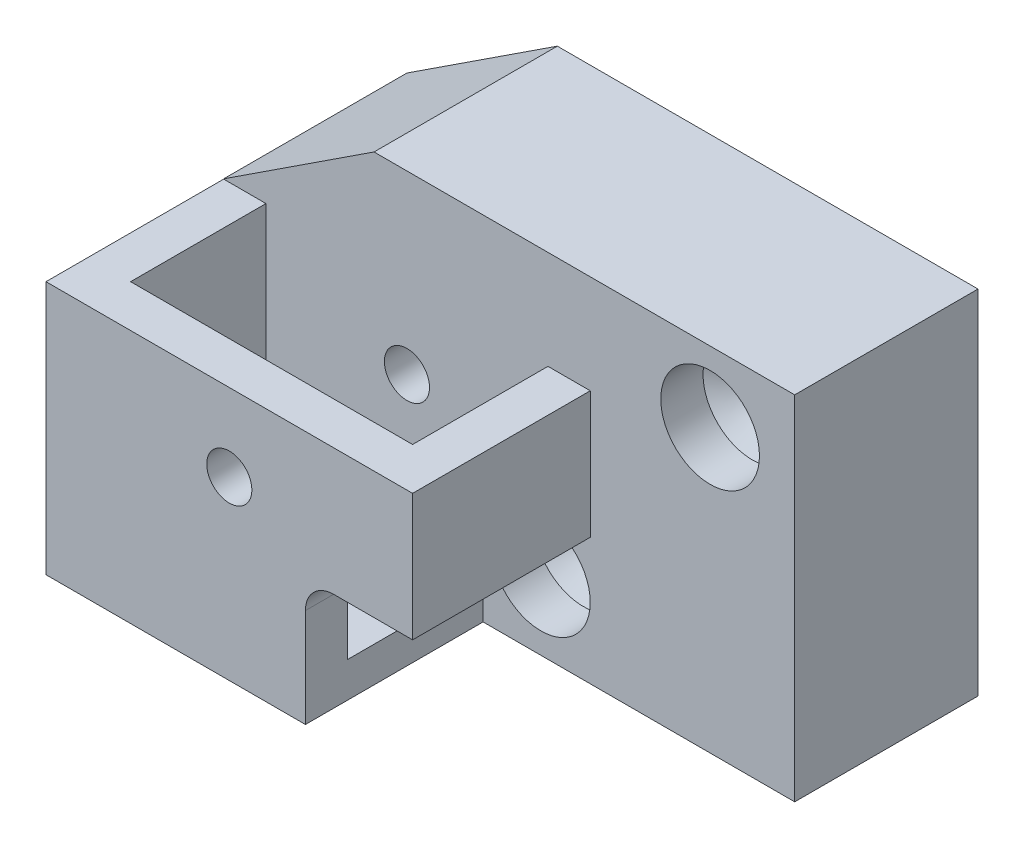
from build123d import *

# Parameters (mm, degrees)
SKETCH_1_W                  = 12.6
SKETCH_1_H                  = 9
EXTRUDE_1_DEPTH             = 3
SKETCH_2_W                  = 3
SKETCH_2_H                  = 9
EXTRUDE_2_DEPTH             = 20
SKETCH_3_W                  = 12.6
SKETCH_3_H                  = 9
EXTRUDE_3_DEPTH             = 3
EXTRUDE_4_DEPTH             = 6.5
SKETCH_5_W                  = 18.4
SKETCH_5_H                  = 12.6
EXTRUDE_5_DEPTH             = 2.5
SKETCH_6_W                  = 40.5
SKETCH_6_H                  = 25
EXTRUDE_6_DEPTH             = 13
CUT_EXTRUDE_1_DEPTH         = 3
HOLE_WIZARD_M31_AT_2_COUNT  = 2
HOLE_WIZARD_M31_AT_2_PITCH  = 19.209372712
SKETCH_10_W                 = 1.6
SKETCH_10_H                 = 13
HOLE_WIZARD_3_2_3_2_2_D     = 3.2
HOLE_WIZARD_3_2_3_2_2_DEPTH = 25.6
CHAMFER_1_SIZE              = 6.981980506
CHAMFER_1_SIZE2             = 10.66515139
FILLET_1_R                  = 2


with BuildPart() as part:
    # Эскиз1 → Бобышка-Вытянуть1 (new body)
    with BuildSketch(Plane(origin=(272.1, 0, 0), x_dir=(0, 0, -1), z_dir=(1, 0, 0))):
        with Locations((-16.8, 19.5)):
            Rectangle(SKETCH_1_W, SKETCH_1_H)
    extrude(amount=-EXTRUDE_1_DEPTH)

    # Эскиз2 → Бобышка-Вытянуть2 (add)
    with BuildSketch(Plane.ZY.offset(-269.1)):
        with Locations((21.6, 19.5)):
            Rectangle(SKETCH_2_W, SKETCH_2_H)
    extrude(amount=EXTRUDE_2_DEPTH)

    # Эскиз3 → Бобышка-Вытянуть3 (add)
    with BuildSketch(Plane.ZY.offset(-249.1)):
        with Locations((16.8, 19.5)):
            Rectangle(SKETCH_3_W, SKETCH_3_H)
    extrude(amount=EXTRUDE_3_DEPTH)

    # Эскиз4 → Бобышка-Вытянуть4 (add)
    with BuildSketch(Plane.XZ.offset(-15)):
        Polygon((264.5, 23.1), (264.5, 20.1), (249.1, 20.1), (249.1, 10.5), (246.1, 10.5), (246.1, 23.1), align=None)
    extrude(amount=EXTRUDE_4_DEPTH)

    # Эскиз5 → Бобышка-Вытянуть5 (add)
    with BuildSketch(Plane.XZ.offset(-8.5)):
        with Locations((255.3, 16.8)):
            Rectangle(SKETCH_5_W, SKETCH_5_H)
    extrude(amount=EXTRUDE_5_DEPTH)

    # Эскиз6 → Бобышка-Вытянуть6 (add)
    with BuildSketch(Plane(origin=(0, 0, 10.5), x_dir=(-1, 0, 0), z_dir=(0, 0, -1))):
        with Locations((-266.35, 18.5)):
            Rectangle(SKETCH_6_W, SKETCH_6_H)
    extrude(amount=EXTRUDE_6_DEPTH)

    # Эскиз7 → Вырез-Вытянуть1 (cut)
    with BuildSketch(Plane(origin=(0, 0, -2.5), x_dir=(-1, 0, 0), z_dir=(0, 0, -1))):
        Polygon((-257.454551733, 15.65), (-255.809103466, 18.5), (-257.454551733, 21.35), (-260.745448267, 21.35), (-262.390896534, 18.5), (-260.745448267, 15.65), align=None)
    extrude(amount=-CUT_EXTRUDE_1_DEPTH, mode=Mode.SUBTRACT)

    # Эскиз8 → Зенковка для  винта с плоской головкой M31 (revolve, cut)
    with BuildSketch(Plane(origin=(280.6, 26, 10.5), x_dir=(0, -1, 0), z_dir=(1, 0, 0))):
        Polygon((0, 0), (0, 13), (1.6, 13), (1.6, 4.141635176), (3.5, 3), (3.5, 0), align=None)
    hole_wizard_m31 = revolve(axis=Axis((280.6, 26, 16.85), (0, 0, -1)), mode=Mode.SUBTRACT)

    # Зенковка для  винта с плоской головкой M31 at 2: Зенковка для  винта с плоской головкой M31 ×2
    with Locations(*[Vector(-0.6246950475544251, -0.7808688094430297, 0) * (i * HOLE_WIZARD_M31_AT_2_PITCH) for i in range(1, HOLE_WIZARD_M31_AT_2_COUNT)]):
        add(hole_wizard_m31, mode=Mode.SUBTRACT)

    # Эскиз10 → Диаметр отверстия Ø3.2 (3.2)1 (revolve, cut)
    with BuildSketch(Plane(origin=(259.1, 18.5, 10.5), x_dir=(0, -1, 0), z_dir=(1, 0, 0))):
        with Locations((0.8, 6.5)):
            Rectangle(SKETCH_10_W, SKETCH_10_H)
    revolve(axis=Axis((259.1, 18.5, 16.85), (0, 0, -1)), mode=Mode.SUBTRACT)

    # Диаметр отверстия Ø3.2 (3.2)2
    with Locations(Plane.XY.offset(23.1)):
        with Locations((259.1, 18.5)):
            Hole(HOLE_WIZARD_3_2_3_2_2_D / 2, depth=HOLE_WIZARD_3_2_3_2_2_DEPTH)

    # Фаска1
    chamfer_1_edges = [part.edges().sort_by_distance(p)[0] for p in [
        (246.1, 31, 4),
    ]]
    chamfer_1_side = [part.faces().sort_by_distance(p)[0] for p in [
        (246.1, 17.061435303, 9.261036607),
    ]]
    chamfer(chamfer_1_edges, length=CHAMFER_1_SIZE, length2=CHAMFER_1_SIZE2, reference=chamfer_1_side[0])

    # Скругление1
    fillet_1_edges = [part.edges().sort_by_distance(p)[0] for p in [
        (264.5, 15, 21.6),
        (249.1, 8.5, 15.3),
    ]]
    fillet(fillet_1_edges, radius=FILLET_1_R)


solid = part.part
